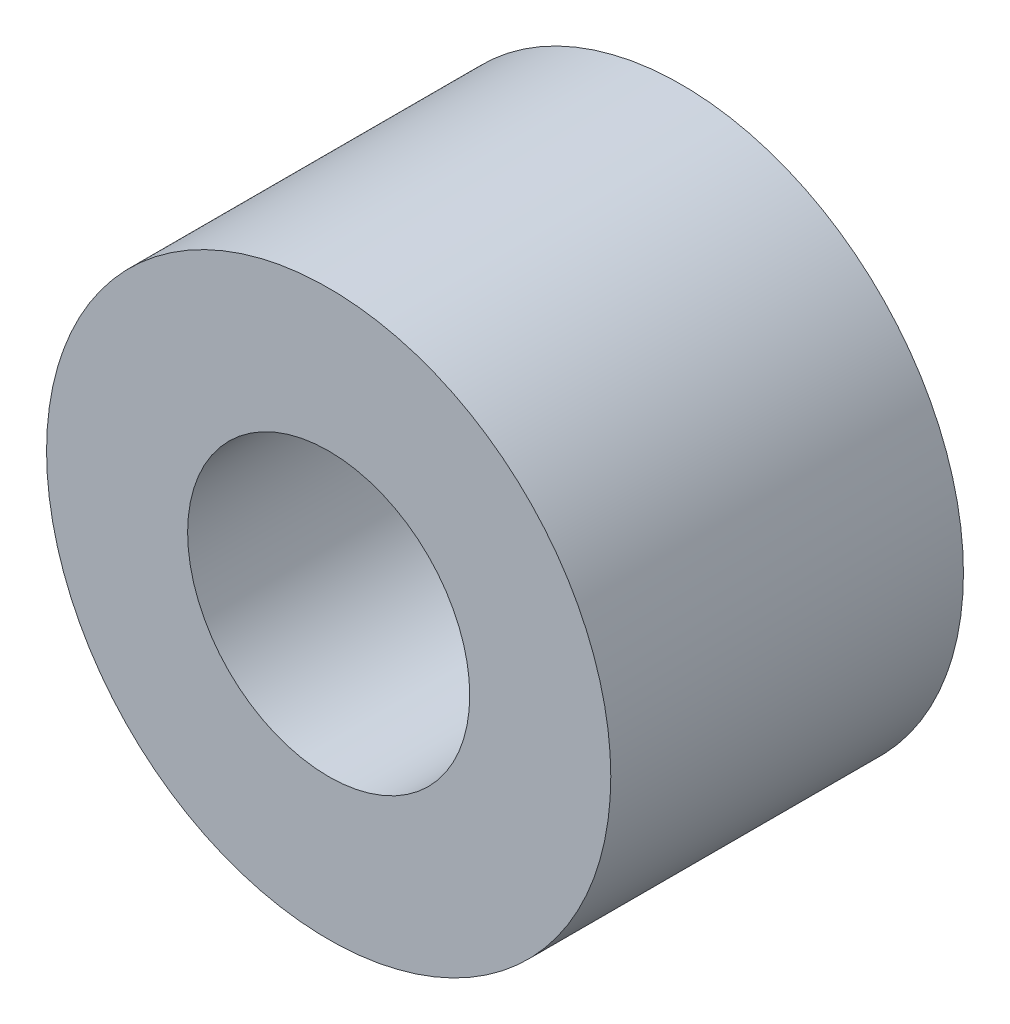
from build123d import *

# Parameters (mm, degrees)
SKETCH1_R           = 2
SKETCH1_R_2         = 1
BOSS_EXTRUDE1_DEPTH = 2.5


with BuildPart() as part:
    # Sketch1 → Boss-Extrude1 (new body)
    with BuildSketch(Plane.XY):
        Circle(SKETCH1_R)
        Circle(SKETCH1_R_2, mode=Mode.SUBTRACT)
    extrude(amount=BOSS_EXTRUDE1_DEPTH)


solid = part.part
